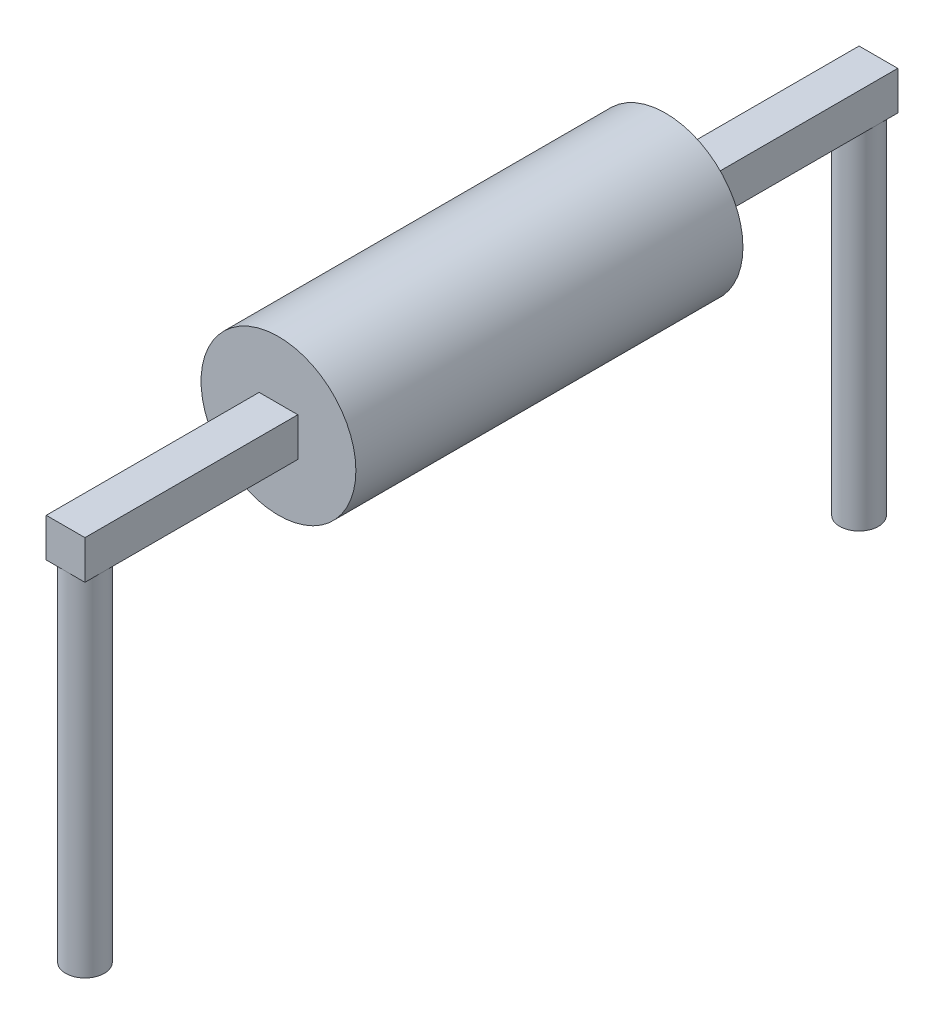
from build123d import *

# Parameters (mm, degrees)
SKETCH_1_R           = 1
EXTRUDE_1_DEPTH      = 5
EXTRUDE_2_DEPTH      = 2.75
EXTRUDE_2_DEPTH_BACK = 7.75
SKETCH_2_W           = 0.5
SKETCH_2_H           = 0.5
SKETCH_3_R           = 0.25
EXTRUDE_3_DEPTH      = 4.5


with BuildPart() as part:
    # Эскиз1 → Вытянуть1 (new body)
    with BuildSketch(Plane.XY):
        Circle(SKETCH_1_R)
    extrude(amount=EXTRUDE_1_DEPTH)

    # Эскиз2 → Вытянуть2 (add, two sides: drawn at the far end of the back side and taken through both)
    with BuildSketch(Plane.XY.offset(5).offset(-EXTRUDE_2_DEPTH_BACK)):
        with Locations((-0.000117439, 0)):
            Rectangle(SKETCH_2_W, SKETCH_2_H)
    extrude(amount=EXTRUDE_2_DEPTH + EXTRUDE_2_DEPTH_BACK)

    # Эскиз3 → Вытянуть3 (add)
    with BuildSketch(Plane.XZ.offset(0.25)):
        with Locations((0, 7.5)):
            Circle(SKETCH_3_R)
        with Locations((0, -2.5)):
            Circle(SKETCH_3_R)
    extrude(amount=EXTRUDE_3_DEPTH)


solid = part.part
